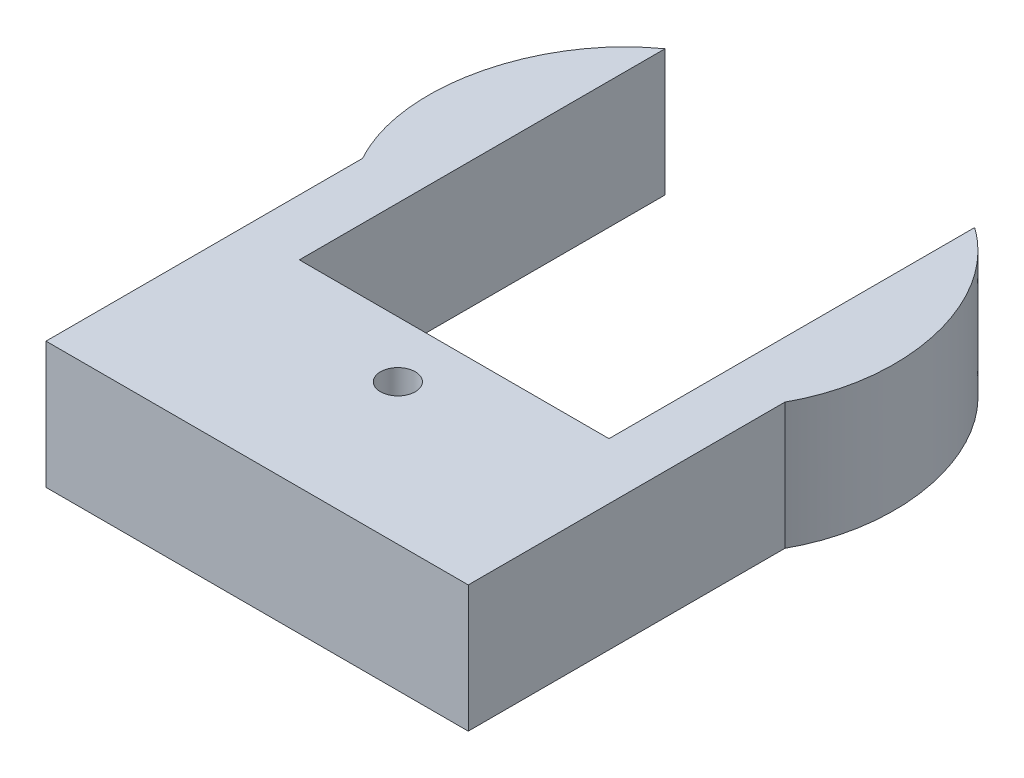
from build123d import *

# Parameters (mm, degrees)
BOSS_EXTRUDE1_DEPTH = 18
SKETCH3_R           = 2.469718116
CUT_EXTRUDE1_DEPTH  = 21


with BuildPart() as part:
    # Sketch1 → Boss-Extrude1 (new body)
    with BuildSketch(Plane(origin=(0, 0, 0), x_dir=(1, 0, 0), z_dir=(0, 1, 0))):
        with BuildLine():
            Line((8, 67.50149873), (8, 79.954057008))
            add(Edge.make_bspline(
                [(0, 45), (-4.267413412, 52.702157849), (-3.849710429, 67.232110416), (4.572220088, 77.524864833), (8, 79.954057008)],
                knots=[0, 0, 0, 0, 0.616858973, 0.90735247, 0.90735247, 0.90735247, 0.90735247], degree=3))
            Line((0, 45), (0, 28))
            Line((0, 28), (0, 0))
            Line((0, 0), (60, 0))
            Line((60, 0), (60, 28))
            Line((60, 28), (60, 45))
            add(Edge.make_bspline(
                [(60, 45), (64.267413412, 52.702157849), (63.849710429, 67.232110416), (55.427779912, 77.524864833), (52, 79.954057008)],
                knots=[0, 0, 0, 0, 0.616858973, 0.90735247, 0.90735247, 0.90735247, 0.90735247], degree=3))
            Line((52, 79.954057008), (52, 70.29729534))
            Line((52, 70.29729534), (52, 28))
            Line((52, 28), (8, 28))
            Line((8, 28), (8, 67.50149873))
        make_face()
    extrude(amount=BOSS_EXTRUDE1_DEPTH)

    # Sketch3 → Cut-Extrude1 (cut)
    with BuildSketch(Plane.XZ):
        with Locations(Location((30, -20, 0), (0, 0, 270))):
            Circle(SKETCH3_R)
    extrude(amount=-CUT_EXTRUDE1_DEPTH, mode=Mode.SUBTRACT)


solid = part.part
